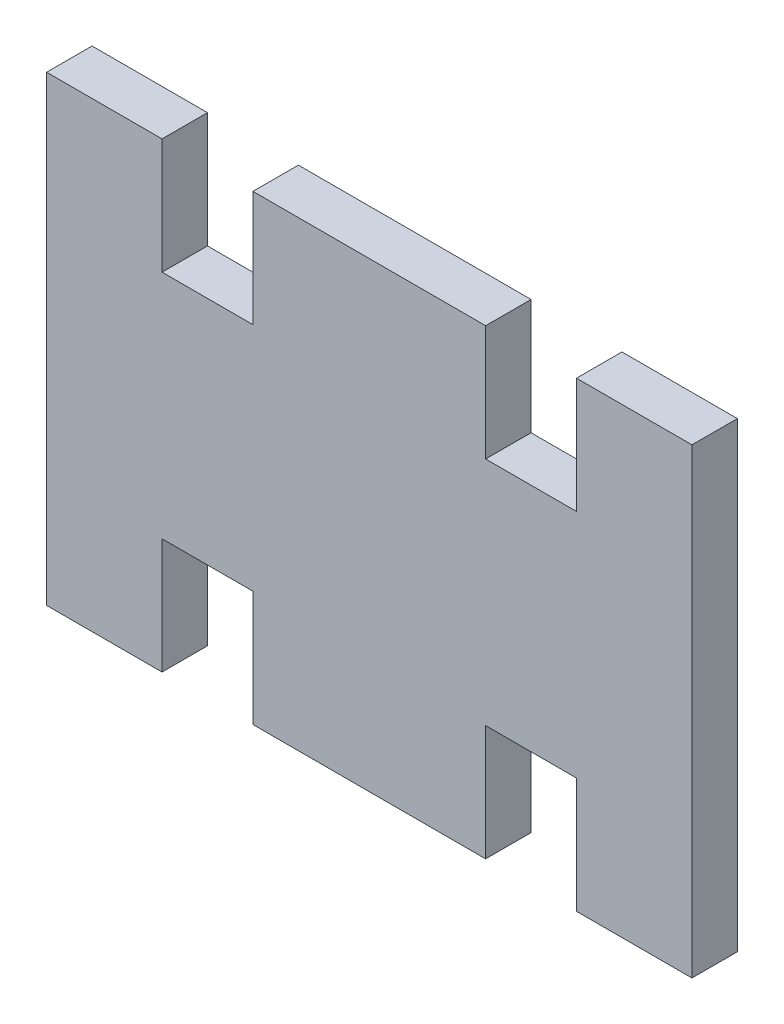
from build123d import *

# Parameters (mm, degrees)
SALIENTE_EXTRUIR1_DEPTH = 5


with BuildPart() as part:
    # Croquis1 → Saliente-Extruir1 (new body)
    with BuildSketch(Plane.XY):
        Polygon((-35.5, 25.4), (-22.8, 25.4), (-22.8, 12.7), (-12.8, 12.7), (-12.8, 25.4), (12.8, 25.4), (12.8, 12.7), (22.8, 12.7), (22.8, 25.4), (35.5, 25.4), (35.5, -25.4), (22.8, -25.4), (22.8, -12.7), (12.8, -12.7), (12.8, -25.4), (-12.8, -25.4), (-12.8, -12.7), (-22.8, -12.7), (-22.8, -25.4), (-35.5, -25.4), align=None)
    extrude(amount=SALIENTE_EXTRUIR1_DEPTH)


solid = part.part
